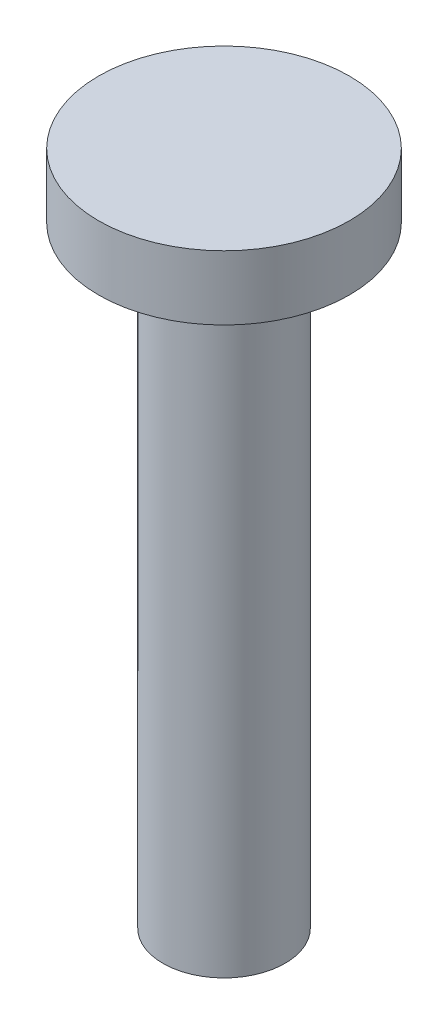
from build123d import *


with BuildPart() as part:
    # Sketch2 → Revolve1 (revolve)
    with BuildSketch(Plane.XY):
        Polygon((0, 0), (0, 19), (-2, 19), (-2, 21), (1.9, 21), (1.9, 0), align=None)
    revolve(axis=Axis((1.9, 21, 0), (0, -1, 0)))


solid = part.part
